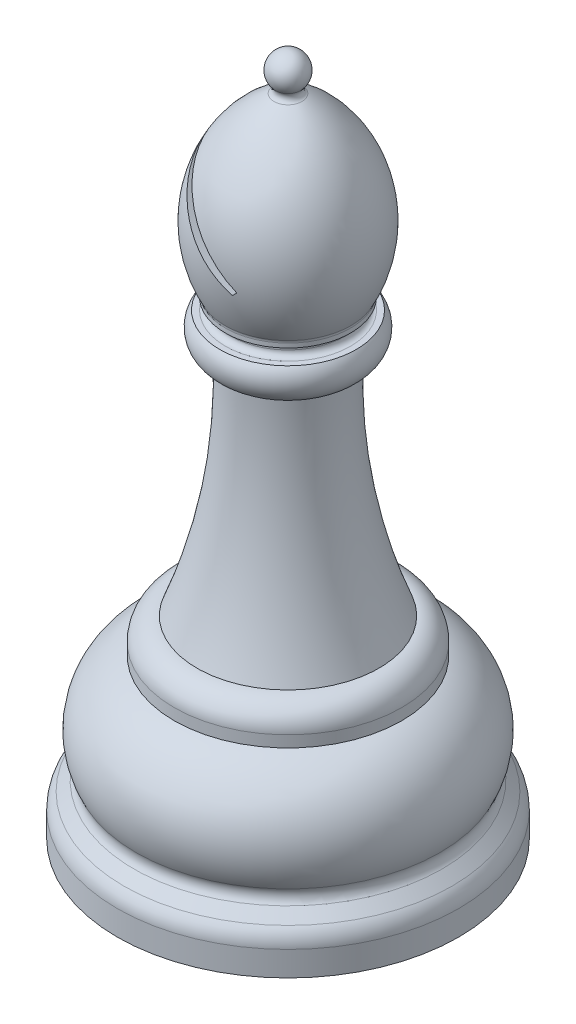
from build123d import *

# Parameters (mm, degrees)
FILLET7_R               = 2
FILLET8_R               = 1
FILLET9_R               = 0.5
FILLET10_R              = 0.5
CUT_EXTRUDE3_DEPTH      = 1
CUT_EXTRUDE3_DEPTH_BACK = 14


with BuildPart() as part:
    # Sketch3 → Revolve1 (revolve)
    with BuildSketch(Plane.XY, mode=Mode.PRIVATE) as revolve1_sk:
        with BuildLine():
            ThreePointArc((0.529133906, 57.096426949), (1.475696374, 58.768924175), (0, 60))
            Line((0, 60), (0, 58.5))
            Line((0, 58.5), (0, 0))
            Line((0, 0), (13, 0))
            Line((13, 0), (15, 0))
            Line((15, 0), (15, 3))
            Line((15, 3), (13, 5))
            ThreePointArc((13, 5), (13.689044296, 10.217121838), (10, 13.97))
            Line((10, 13.97), (10, 14.97))
            ThreePointArc((10, 14.97), (9.414213562, 16.384213562), (8, 16.97))
            ThreePointArc((8, 16.97), (5.315747627, 26.799969862), (4.680133538, 36.97))
            ThreePointArc((4.680133538, 36.97), (6.310846591, 38.206963273), (6, 40.23))
            Line((6, 40.23), (5, 40.23))
            Line((5, 40.23), (5, 41.23))
            Line((5, 41.23), (5.5, 41.23))
            Line((5.5, 41.23), (5.5, 41.73))
            ThreePointArc((5.5, 41.73), (6.295705275, 50.474624776), (0.529133906, 57.096426949))
        make_face()
    revolve(revolve1_sk.sketch.rotate(Axis((0, 60, 0), (0, -1, 0)), 180), axis=Axis((0, 60, 0), (0, -1, 0)))

    # Fillet7
    fillet7_edges = [part.edges().sort_by_distance(p)[0] for p in [
        (15, 3, 0),
    ]]
    fillet(fillet7_edges, radius=FILLET7_R)

    # Fillet8
    fillet8_edges = [part.edges().sort_by_distance(p)[0] for p in [
        (13, 5, 0),
    ]]
    fillet(fillet8_edges, radius=FILLET8_R)

    # Fillet9
    fillet9_edges = [part.edges().sort_by_distance(p)[0] for p in [
        (5, 40.23, 0),
    ]]
    fillet(fillet9_edges, radius=FILLET9_R)

    # Fillet10
    fillet10_edges = [part.edges().sort_by_distance(p)[0] for p in [
        (0.529133906, 57.096426949, 0),
        (5.5, 41.73, 0),
    ]]
    fillet(fillet10_edges, radius=FILLET10_R)

    # Sketch4 → Cut-Extrude3 (cut, two sides: drawn at the far end of the back side and taken through both)
    with BuildSketch(Plane.XY.offset(6.505754049).offset(-CUT_EXTRUDE3_DEPTH_BACK)):
        with BuildLine():
            Line((1.642550832, 45.422425081), (1.972584895, 45.752459144))
            Line((1.972584895, 45.752459144), (-6.308521806, 54.040241883))
            ThreePointArc((-6.308521806, 54.040241883), (-2.803882994, 49.296868424), (1.642550832, 45.422425081))
        make_face()
    extrude(amount=CUT_EXTRUDE3_DEPTH + CUT_EXTRUDE3_DEPTH_BACK, mode=Mode.SUBTRACT)


solid = part.part
